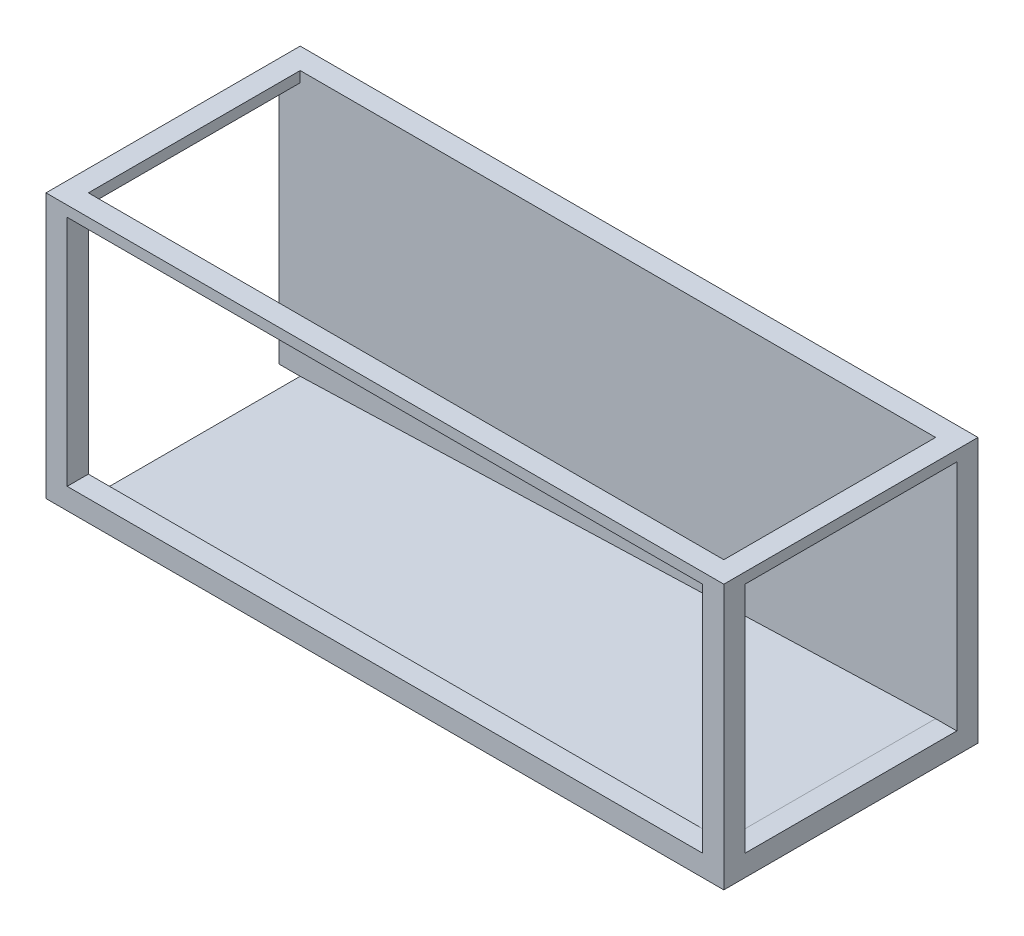
from build123d import *

# Parameters (mm, degrees)
SKETCH1_W                                  = 406.4
SKETCH1_H                                  = 152.4
SKETCH1_W_2                                = 381
SKETCH1_H_2                                = 127
BOSS_EXTRUDE1_DEPTH                        = 12.7
SKETCH2_W                                  = 12.7
SKETCH2_H                                  = 12.7
BOSS_EXTRUDE2_DEPTH                        = 146.05
MIRROR1_AT_THE_SECOND_PLANE_COPY_1_SKETC_W = 12.7
MIRROR1_AT_THE_SECOND_PLANE_COPY_1_SKETC_H = 12.7
MIRROR1_AT_THE_SECOND_PLANE_COPY_1_DEPTH   = 146.05
SKETCH3_W                                  = 406.4
SKETCH3_H                                  = 152.4
SKETCH3_W_2                                = 381
SKETCH3_H_2                                = 127
BOSS_EXTRUDE3_DEPTH                        = 6.35
SKETCH4_W                                  = 406.4
SKETCH4_H                                  = 158.75
BOSS_EXTRUDE4_DEPTH                        = 12.7
SKETCH6_W                                  = 12.7
SKETCH6_H                                  = 12.7
CUT_EXTRUDE1_DEPTH                         = 127
BOSS_EXTRUDE6_DEPTH                        = 127


with BuildPart() as part:
    # Sketch1 → Boss-Extrude1 (new body)
    with BuildSketch(Plane(origin=(0, 0, 0), x_dir=(1, 0, 0), z_dir=(0, 1, 0))):
        Rectangle(SKETCH1_W, SKETCH1_H)
        Rectangle(SKETCH1_W_2, SKETCH1_H_2, mode=Mode.SUBTRACT)
    extrude(amount=BOSS_EXTRUDE1_DEPTH)

    # Sketch2 → Boss-Extrude2 (add)
    with BuildSketch(Plane(origin=(0, 12.7, 0), x_dir=(1, 0, 0), z_dir=(0, 1, 0))):
        with Locations((-196.85, -69.85)):
            Rectangle(SKETCH2_W, SKETCH2_H)
    boss_extrude2 = extrude(amount=BOSS_EXTRUDE2_DEPTH)

    # Mirror1: Boss-Extrude2 across plane
    add(boss_extrude2.mirror(Plane(origin=(0, 0, 0), x_dir=(0, 0, 1), z_dir=(1, 0, 0))))

    # Mirror1 at the second plane: Boss-Extrude2 across plane
    add(boss_extrude2.mirror(Plane.XY))

    # Mirror1 at the second plane copy 1 sketc → Mirror1 at the second plane copy 1 (add)
    with BuildSketch(Plane(origin=(0, 12.7, 0), x_dir=(-1, 0, 0), z_dir=(0, 1, 0))):
        with Locations((-196.85, -69.85)):
            Rectangle(MIRROR1_AT_THE_SECOND_PLANE_COPY_1_SKETC_W, MIRROR1_AT_THE_SECOND_PLANE_COPY_1_SKETC_H)
    extrude(amount=MIRROR1_AT_THE_SECOND_PLANE_COPY_1_DEPTH)

    # Sketch3 → Boss-Extrude3 (add)
    with BuildSketch(Plane(origin=(0, 158.75, 0), x_dir=(1, 0, 0), z_dir=(0, 1, 0))):
        Rectangle(SKETCH3_W, SKETCH3_H)
        Rectangle(SKETCH3_W_2, SKETCH3_H_2, mode=Mode.SUBTRACT)
    extrude(amount=-BOSS_EXTRUDE3_DEPTH)

    # Sketch4 → Boss-Extrude4 (add)
    with BuildSketch(Plane(origin=(0, 0, -76.2), x_dir=(-1, 0, 0), z_dir=(0, 0, -1))):
        with Locations((0, 79.375)):
            Rectangle(SKETCH4_W, SKETCH4_H)
    extrude(amount=-BOSS_EXTRUDE4_DEPTH)

    # Sketch6 → Cut-Extrude1 (cut)
    with BuildSketch(Plane.XY.offset(-63.5)):
        with Locations((-196.85, 6.35)):
            Rectangle(SKETCH6_W, SKETCH6_H)
    extrude(amount=CUT_EXTRUDE1_DEPTH, mode=Mode.SUBTRACT)

    # Sketch5 → Boss-Extrude6 (add)
    with BuildSketch(Plane.XY.offset(-63.5)):
        Polygon((190.5, 12.7), (-190.5, 0), (190.5, 0), align=None)
    extrude(amount=BOSS_EXTRUDE6_DEPTH)


solid = part.part
